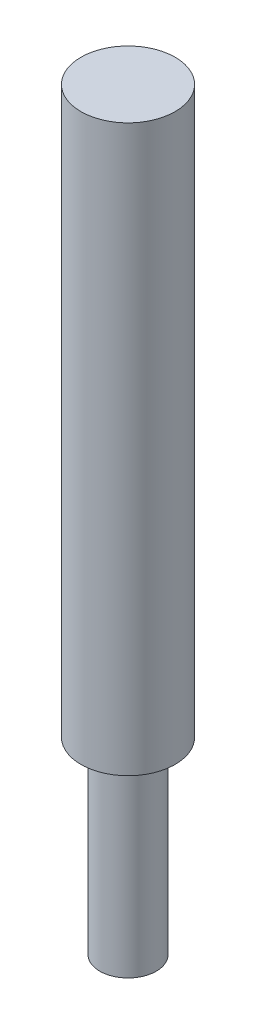
from build123d import *

# Parameters (mm, degrees)
SKETCH1_R           = 2.5
BOSS_EXTRUDE1_DEPTH = 40
SKETCH2_R           = 2.5
SKETCH2_R_2         = 1.5
CUT_EXTRUDE1_DEPTH  = 10


with BuildPart() as part:
    # Sketch1 → Boss-Extrude1 (new body)
    with BuildSketch(Plane(origin=(0, 0, 0), x_dir=(1, 0, 0), z_dir=(0, 1, 0))):
        with Locations(Location((0, 0, 0), (0, 0, 270))):
            Circle(SKETCH1_R)
    extrude(amount=BOSS_EXTRUDE1_DEPTH)

    # Sketch2 → Cut-Extrude1 (cut)
    with BuildSketch(Plane.XZ):
        with Locations(Location((0, 0, 0), (0, 0, 270))):
            Circle(SKETCH2_R)
        with Locations(Location((0, 0, 0), (0, 0, 270))):
            Circle(SKETCH2_R_2, mode=Mode.SUBTRACT)
    extrude(amount=-CUT_EXTRUDE1_DEPTH, mode=Mode.SUBTRACT)


solid = part.part
